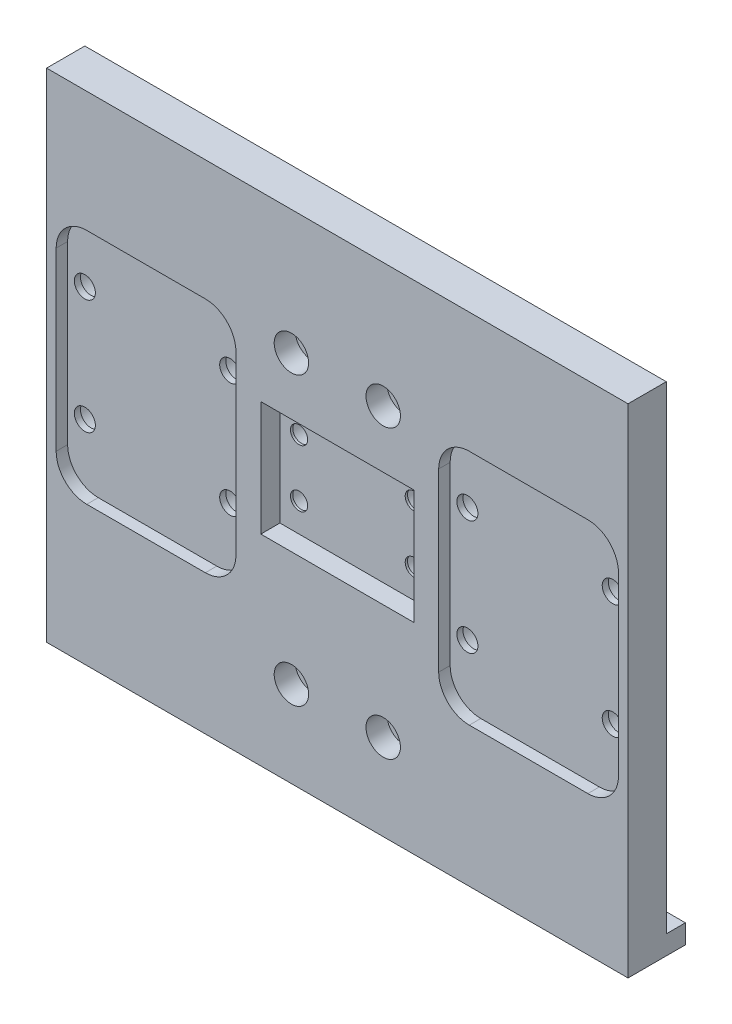
from build123d import *

# Parameters (mm, degrees)
SKETCH3_W                                           = 152
SKETCH3_H                                           = 125
BOSS_EXTRUDE2_DEPTH                                 = 10
KES_EKSTR_ZYON1_DEPTH                               = 3
CBORE_FOR_M5_HEX_SOCKET_HEAD_CAP_SCREW1_D           = 5.8
CBORE_FOR_M5_HEX_SOCKET_HEAD_CAP_SCREW1_DEPTH       = 15
CBORE_FOR_M5_HEX_SOCKET_HEAD_CAP_SCREW1_CBORE_D     = 9
CBORE_FOR_M5_HEX_SOCKET_HEAD_CAP_SCREW1_CBORE_DEPTH = 5.5
CBORE_FOR_M5_HEX_SOCKET_HEAD_CAP_SCREW1_TIP         = 1.742495795
CBORE_FOR_M5_HEX_SOCKET_HEAD_CAP_SCREW2_D           = 5.5
CBORE_FOR_M5_HEX_SOCKET_HEAD_CAP_SCREW2_CBORE_D     = 10
CBORE_FOR_M5_HEX_SOCKET_HEAD_CAP_SCREW2_CBORE_DEPTH = 5.4
CBORE_FOR_M4_HEX_SOCKET_HEAD_CAP_SCREW2_D           = 4.5
CBORE_FOR_M4_HEX_SOCKET_HEAD_CAP_SCREW2_CBORE_D     = 8
CBORE_FOR_M4_HEX_SOCKET_HEAD_CAP_SCREW2_CBORE_DEPTH = 4.4
SKETCH13_W                                          = 40
SKETCH13_H                                          = 30
CUT_EXTRUDE1_DEPTH                                  = 5
SKETCH14_W                                          = 15
SKETCH14_H                                          = 5
BOSS_EXTRUDE3_DEPTH                                 = 152


with BuildPart() as part:
    # Sketch3 → Boss-Extrude2 (new body)
    with BuildSketch(Plane.XY):
        Rectangle(SKETCH3_W, SKETCH3_H)
    extrude(amount=BOSS_EXTRUDE2_DEPTH)

    # Çizim2 → Kes-Ekstrüzyon1 (cut)
    with BuildSketch(Plane.XY.offset(10)):
        with BuildLine():
            Line((-34.5, -31), (-65.5, -31))
            ThreePointArc((-65.5, -31), (-71.156854249, -28.656854249), (-73.5, -23))
            Line((-73.5, -23), (-73.5, 23))
            ThreePointArc((-73.5, 23), (-71.156854249, 28.656854249), (-65.5, 31))
            Line((-65.5, 31), (-34.5, 31))
            ThreePointArc((-34.5, 31), (-28.843145751, 28.656854249), (-26.5, 23))
            Line((-26.5, 23), (-26.5, -23))
            ThreePointArc((-26.5, -23), (-28.843145751, -28.656854249), (-34.5, -31))
        make_face()
        with BuildLine():
            Line((65.5, -31), (34.5, -31))
            ThreePointArc((34.5, -31), (28.843145751, -28.656854249), (26.5, -23))
            Line((26.5, -23), (26.5, 23))
            ThreePointArc((26.5, 23), (28.843145751, 28.656854249), (34.5, 31))
            Line((34.5, 31), (65.5, 31))
            ThreePointArc((65.5, 31), (71.156854249, 28.656854249), (73.5, 23))
            Line((73.5, 23), (73.5, -23))
            ThreePointArc((73.5, -23), (71.156854249, -28.656854249), (65.5, -31))
        make_face()
    extrude(amount=-KES_EKSTR_ZYON1_DEPTH, mode=Mode.SUBTRACT)

    # CBORE for M5 Hex Socket Head Cap Screw1
    with Locations(Plane.XY.offset(10)):
        with Locations((-12, 30), (12, 30), (-12, -45), (12, -45)):
            CounterBoreHole(CBORE_FOR_M5_HEX_SOCKET_HEAD_CAP_SCREW1_D / 2, CBORE_FOR_M5_HEX_SOCKET_HEAD_CAP_SCREW1_CBORE_D / 2, CBORE_FOR_M5_HEX_SOCKET_HEAD_CAP_SCREW1_CBORE_DEPTH, depth=CBORE_FOR_M5_HEX_SOCKET_HEAD_CAP_SCREW1_DEPTH)
            with Locations((0, 0, -(CBORE_FOR_M5_HEX_SOCKET_HEAD_CAP_SCREW1_DEPTH + CBORE_FOR_M5_HEX_SOCKET_HEAD_CAP_SCREW1_TIP / 2))):  # 118° drill point
                Cone(0, CBORE_FOR_M5_HEX_SOCKET_HEAD_CAP_SCREW1_D / 2, CBORE_FOR_M5_HEX_SOCKET_HEAD_CAP_SCREW1_TIP, mode=Mode.SUBTRACT)

    # CBORE for M5 Hex Socket Head Cap Screw2 (through all)
    with Locations(Plane(origin=(0, 0, 0), x_dir=(1, 0, 0), z_dir=(0, 0, -1))):
        with Locations((-69, -15), (-31, -15), (-69, 15), (-31, 15), (31, -15), (31, 15), (69, 15), (69, -15)):
            CounterBoreHole(CBORE_FOR_M5_HEX_SOCKET_HEAD_CAP_SCREW2_D / 2, CBORE_FOR_M5_HEX_SOCKET_HEAD_CAP_SCREW2_CBORE_D / 2, CBORE_FOR_M5_HEX_SOCKET_HEAD_CAP_SCREW2_CBORE_DEPTH)

    # CBORE for M4 Hex Socket Head Cap Screw2 (through all)
    with Locations(Plane(origin=(0, 0, 0), x_dir=(-1, 0, 0), z_dir=(0, 0, -1))):
        with Locations((-15, 7.5), (-15, -7.5), (15, 7.5), (15, -7.5)):
            CounterBoreHole(CBORE_FOR_M4_HEX_SOCKET_HEAD_CAP_SCREW2_D / 2, CBORE_FOR_M4_HEX_SOCKET_HEAD_CAP_SCREW2_CBORE_D / 2, CBORE_FOR_M4_HEX_SOCKET_HEAD_CAP_SCREW2_CBORE_DEPTH)

    # Sketch13 → Cut-Extrude1 (cut)
    with BuildSketch(Plane.XY.offset(10)):
        Rectangle(SKETCH13_W, SKETCH13_H)
    extrude(amount=-CUT_EXTRUDE1_DEPTH, mode=Mode.SUBTRACT)

    # Sketch14 → Boss-Extrude3 (add)
    with BuildSketch(Plane.ZY.offset(-76)):
        with Locations((2.5, -65)):
            Rectangle(SKETCH14_W, SKETCH14_H)
    extrude(amount=BOSS_EXTRUDE3_DEPTH)


solid = part.part
